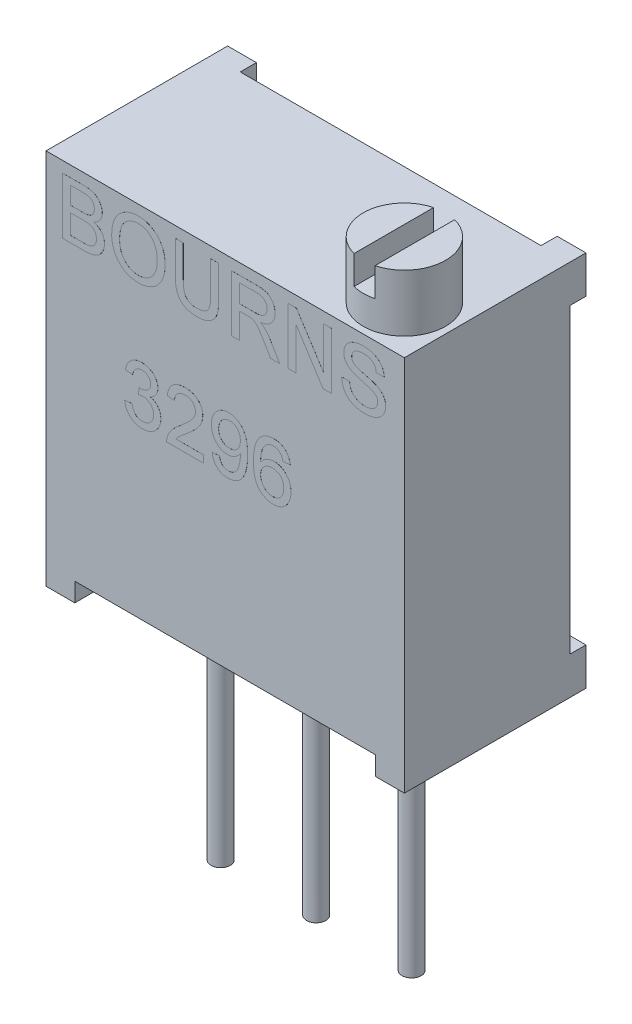
from build123d import *

# Parameters (mm, degrees)
SKETCH1_W          = 9.53
SKETCH1_H          = 10.03
EXTRUDE1_DEPTH     = 4.4
SKETCH2_W          = 8
SKETCH2_H          = 0.5
CUT_EXTRUDE1_DEPTH = 12.94429257
SKETCH3_W          = 0.765
SKETCH3_H          = 1
EXTRUDE2_DEPTH     = 0.43
SKETCH4_R          = 0.255
EXTRUDE3_DEPTH     = 6.9
SKETCH5_R          = 1.095
EXTRUDE4_DEPTH     = 1.52
SKETCH6_W          = 0.56
SKETCH6_H          = 3.177194403
CUT_EXTRUDE2_DEPTH = 0.76
EXTRUDE5_DEPTH     = 0.001


with BuildPart() as part:
    # Sketch1 → Extrude1 (new body)
    with BuildSketch(Plane.XY):
        with Locations((0, 5.015)):
            Rectangle(SKETCH1_W, SKETCH1_H)
    extrude(amount=EXTRUDE1_DEPTH)

    # Sketch2 → Cut-Extrude1 (cut, through all)
    with BuildSketch(Plane.XY.offset(4.4)):
        with Locations((0, 0.25)):
            Rectangle(SKETCH2_W, SKETCH2_H)
    extrude(amount=-CUT_EXTRUDE1_DEPTH, mode=Mode.SUBTRACT)

    # Sketch3 → Extrude2 (add)
    with BuildSketch(Plane(origin=(0, 0, 0), x_dir=(-1, 0, 0), z_dir=(0, 0, -1))):
        with Locations((-4.3825, 0.5)):
            Rectangle(SKETCH3_W, SKETCH3_H)
        with Locations((4.3825, 0.5)):
            Rectangle(SKETCH3_W, SKETCH3_H)
        with Locations((4.3825, 9.53)):
            Rectangle(SKETCH3_W, SKETCH3_H)
        with Locations((-4.3825, 9.53)):
            Rectangle(SKETCH3_W, SKETCH3_H)
    extrude(amount=EXTRUDE2_DEPTH)

    # Sketch4 → Extrude3 (add)
    with BuildSketch(Plane.XZ.offset(-0.5)):
        with Locations(Location((2.54, 1.98, 0), (0, 0, 90))):
            Circle(SKETCH4_R)
        with Locations(Location((0, 1.98, 0), (0, 0, 90))):
            Circle(SKETCH4_R)
        with Locations(Location((-2.54, 1.98, 0), (0, 0, 90))):
            Circle(SKETCH4_R)
    extrude(amount=EXTRUDE3_DEPTH)

    # Sketch5 → Extrude4 (add)
    with BuildSketch(Plane(origin=(0, 10.03, 0), x_dir=(-1, 0, 0), z_dir=(0, 1, 0))):
        with Locations(Location((-3.495, 3.13, 0), (0, 0, 270))):
            Circle(SKETCH5_R)
    extrude(amount=EXTRUDE4_DEPTH)

    # Sketch6 → Cut-Extrude2 (cut)
    with BuildSketch(Plane(origin=(0, 11.55, 0), x_dir=(-1, 0, 0), z_dir=(0, 1, 0))):
        with Locations((-3.495, 3.181606458)):
            Rectangle(SKETCH6_W, SKETCH6_H)
    extrude(amount=-CUT_EXTRUDE2_DEPTH, mode=Mode.SUBTRACT)

    # Sketch7 → Extrude5 (add)
    # profile 1 of 10: a face of its own
    with BuildSketch(Plane.XY.offset(4.4)):
        with BuildLine():
            Line((-4.326444342, 8.237150921), (-4.326444342, 9.737150921))
            Line((-4.326444342, 9.737150921), (-3.764845784, 9.737150921))
            add(Edge.make_bspline(
                [(-3.764845784, 9.737150921), (-3.750919069, 9.737097495), (-3.723744088, 9.736993245), (-3.684062996, 9.734386066), (-3.64648204, 9.730819986), (-3.610920315, 9.726223199), (-3.577531697, 9.719553354), (-3.5463473, 9.711473284), (-3.517204841, 9.702153183), (-3.481582627, 9.687955652), (-3.44053193, 9.666102632), (-3.396562734, 9.63349448), (-3.358307825, 9.594343785), (-3.326829661, 9.549455296), (-3.300895048, 9.501505925), (-3.282507712, 9.451409151), (-3.270751692, 9.400255705), (-3.269417834, 9.365618225), (-3.268752034, 9.348328806)],
                knots=[0, 0, 0, 0, 0.939712594, 1.833646414, 2.682508961, 3.487467313, 4.25240329, 4.978730417, 5.660668875, 6.315918528, 7.564895217, 8.787077865, 9.996481721, 11.241996224, 12.475862915, 13.665015424, 14.834484263, 16, 16, 16, 16], degree=3))
            add(Edge.make_bspline(
                [(-3.268752034, 9.348328806), (-3.26945193, 9.332243346), (-3.270844975, 9.300227505), (-3.281932051, 9.253066225), (-3.29943085, 9.207272915), (-3.324174647, 9.163404285), (-3.35580032, 9.122262901), (-3.395007125, 9.085240754), (-3.441231661, 9.052258501), (-3.475923175, 9.03467799), (-3.49381213, 9.025612459)],
                knots=[0, 0, 0, 0, 0.926741525, 1.844548388, 2.778836836, 3.746021974, 4.738420572, 5.759761325, 6.844803049, 8, 8, 8, 8], degree=3))
            add(Edge.make_bspline(
                [(-3.49381213, 9.025612459), (-3.482745904, 9.022148256), (-3.461080115, 9.015365935), (-3.429933293, 9.002955239), (-3.40069594, 8.988823885), (-3.373304413, 8.972948652), (-3.347943795, 8.955182527), (-3.324685642, 8.935497814), (-3.303368694, 8.914199128), (-3.284031035, 8.891299426), (-3.267044931, 8.866946071), (-3.251810517, 8.841671332), (-3.2392306, 8.815170846), (-3.228919301, 8.787513414), (-3.220874955, 8.758869935), (-3.215098238, 8.729130241), (-3.211805658, 8.698363557), (-3.211311122, 8.677463121), (-3.211059726, 8.666838421)],
                knots=[0, 0, 0, 0, 1.127427615, 2.20731145, 3.257257018, 4.283066884, 5.282973838, 6.264540225, 7.242620376, 8.210460609, 9.17525685, 10.12748095, 11.077310519, 12.023587065, 12.994999128, 13.967387486, 14.966724908, 16, 16, 16, 16], degree=3))
            add(Edge.make_bspline(
                [(-3.211059726, 8.666838421), (-3.211577892, 8.649780613), (-3.212604959, 8.615969962), (-3.220853456, 8.56620637), (-3.234792977, 8.518337989), (-3.253979542, 8.473138792), (-3.276841107, 8.43134548), (-3.302824076, 8.394052338), (-3.331265831, 8.36164311), (-3.362967261, 8.334381157), (-3.397723879, 8.311243736), (-3.436517359, 8.291760514), (-3.479047757, 8.27457818), (-3.526179479, 8.260852297), (-3.577891071, 8.249948474), (-3.634884306, 8.242864242), (-3.697246747, 8.237792882), (-3.74069542, 8.237370888), (-3.76334338, 8.237150921)],
                knots=[0, 0, 0, 0, 1.028073207, 2.037766189, 3.031549473, 4.027532207, 4.992436545, 5.898794514, 6.762903869, 7.584966804, 8.412380356, 9.273953678, 10.198004568, 11.174406109, 12.229717296, 13.381036288, 14.634844708, 16, 16, 16, 16], degree=3))
            Line((-3.76334338, 8.237150921), (-4.326444342, 8.237150921))
        make_face()
        with BuildLine():
            Line((-4.11490588, 9.102535536), (-3.805711169, 9.102535536))
            add(Edge.make_bspline(
                [(-3.805711169, 9.102535536), (-3.795593548, 9.102575565), (-3.776155313, 9.10265247), (-3.748116122, 9.103724756), (-3.722237293, 9.104639569), (-3.698618928, 9.106935678), (-3.677144021, 9.109184615), (-3.65789851, 9.112212035), (-3.640788132, 9.115623251), (-3.630311444, 9.11878741), (-3.625422707, 9.120263902)],
                knots=[0, 0, 0, 0, 1.335841395, 2.566453063, 3.705076039, 4.753984432, 5.69893722, 6.555639608, 7.326018133, 8, 8, 8, 8], degree=3))
            add(Edge.make_bspline(
                [(-3.625422707, 9.120263902), (-3.613935929, 9.124287721), (-3.591791825, 9.132044802), (-3.562116654, 9.149661914), (-3.536842034, 9.170802362), (-3.516035695, 9.195839435), (-3.500047055, 9.224639144), (-3.48819194, 9.256604254), (-3.481701001, 9.292181608), (-3.480773445, 9.316853252), (-3.480290496, 9.329698998)],
                knots=[0, 0, 0, 0, 1.059015028, 2.041559358, 2.989777133, 3.920090524, 4.862499371, 5.848878527, 6.879979022, 8, 8, 8, 8], degree=3))
            add(Edge.make_bspline(
                [(-3.480290496, 9.329698998), (-3.480678819, 9.342044591), (-3.481435618, 9.366104727), (-3.487788265, 9.401044217), (-3.498781285, 9.433548996), (-3.513668845, 9.463611935), (-3.532520451, 9.490357237), (-3.555020501, 9.513351936), (-3.581973973, 9.530734916), (-3.607167395, 9.541578455), (-3.629826882, 9.548362111), (-3.650072338, 9.552375722), (-3.673036723, 9.555912112), (-3.698795607, 9.558918633), (-3.727358734, 9.56125197), (-3.758814112, 9.563105652), (-3.793086864, 9.56389268), (-3.816828774, 9.564012054), (-3.829148669, 9.564073998)],
                knots=[0, 0, 0, 0, 1.216168307, 2.37017178, 3.484610845, 4.588286376, 5.664695412, 6.69777344, 7.738183022, 8.803673002, 9.390844981, 10.0665252, 10.835811589, 11.680682236, 12.621801058, 13.660007223, 14.785756265, 16, 16, 16, 16], degree=3))
            Line((-3.829148669, 9.564073998), (-4.11490588, 9.564073998))
            Line((-4.11490588, 9.564073998), (-4.11490588, 9.102535536))
        make_face(mode=Mode.SUBTRACT)
        with BuildLine():
            Line((-4.11490588, 8.410227844), (-3.760038092, 8.410227844))
            add(Edge.make_bspline(
                [(-3.760038092, 8.410227844), (-3.745915172, 8.410390096), (-3.719967473, 8.410688199), (-3.68447609, 8.41162336), (-3.655788079, 8.41390761), (-3.639035797, 8.416367164), (-3.631732803, 8.417439383)],
                knots=[0, 0, 0, 0, 1.317581857, 2.420761387, 3.311546315, 4, 4, 4, 4], degree=3))
            add(Edge.make_bspline(
                [(-3.631732803, 8.417439383), (-3.621262478, 8.419640139), (-3.60098922, 8.423901372), (-3.572408792, 8.433412), (-3.546204152, 8.444306931), (-3.522832664, 8.458153179), (-3.501191226, 8.47411003), (-3.482383206, 8.494040902), (-3.465060127, 8.516685746), (-3.450051204, 8.542600195), (-3.43791431, 8.571268479), (-3.42863829, 8.602247654), (-3.423697206, 8.635429101), (-3.422969697, 8.658209966), (-3.422598188, 8.669843229)],
                knots=[0, 0, 0, 0, 1.067651492, 2.067249321, 3.003744366, 3.895862395, 4.774133402, 5.679610569, 6.621910665, 7.616993802, 8.661192143, 9.724711987, 10.838102842, 12, 12, 12, 12], degree=3))
            add(Edge.make_bspline(
                [(-3.422598188, 8.669843229), (-3.42301209, 8.683501376), (-3.42381924, 8.710136157), (-3.431491485, 8.748624765), (-3.444164778, 8.784323428), (-3.462005081, 8.816737755), (-3.483887144, 8.845891651), (-3.51036223, 8.870622107), (-3.541232376, 8.890246947), (-3.576592458, 8.905648649), (-3.617921311, 8.916606694), (-3.666359943, 8.924041064), (-3.722683143, 8.928838285), (-3.762931606, 8.929242981), (-3.784377034, 8.929458613)],
                knots=[0, 0, 0, 0, 0.96167883, 1.875371887, 2.752872588, 3.621584364, 4.472914353, 5.312011319, 6.159851575, 7.038572308, 8.019870099, 9.164119506, 10.488969081, 12, 12, 12, 12], degree=3))
            Line((-3.784377034, 8.929458613), (-4.11490588, 8.929458613))
            Line((-4.11490588, 8.929458613), (-4.11490588, 8.410227844))
        make_face(mode=Mode.SUBTRACT)
    # profile 2 of 10: a face of its own
    with BuildSketch(Plane.XY.offset(4.4)):
        with BuildLine():
            add(Edge.make_bspline(
                [(-3.018752034, 8.96731919), (-3.018230692, 8.997392897), (-3.017214883, 9.055989991), (-3.007723632, 9.141314909), (-2.992312277, 9.221594495), (-2.970280381, 9.296822497), (-2.942354889, 9.367116795), (-2.90840612, 9.432636561), (-2.867412916, 9.492640158), (-2.821039156, 9.547698782), (-2.769241797, 9.596374641), (-2.714092331, 9.639605778), (-2.654902115, 9.675665657), (-2.592218021, 9.705439229), (-2.525773732, 9.728298516), (-2.455755803, 9.744302096), (-2.382239117, 9.754625961), (-2.331988742, 9.755787946), (-2.30631213, 9.75638169)],
                knots=[0, 0, 0, 0, 1.203621547, 2.345195544, 3.432004029, 4.472479546, 5.478447225, 6.455936844, 7.420185704, 8.381829745, 9.332027588, 10.260832629, 11.182364398, 12.100723901, 13.034044877, 13.989196293, 14.972532542, 16, 16, 16, 16], degree=3))
            add(Edge.make_bspline(
                [(-2.30631213, 9.75638169), (-2.289376641, 9.756085965), (-2.255745821, 9.755498707), (-2.206025657, 9.751030463), (-2.157583125, 9.74305542), (-2.110465931, 9.732367968), (-2.064545821, 9.718346497), (-2.019795371, 9.701794576), (-1.976606323, 9.681284416), (-1.934691352, 9.658321251), (-1.894545231, 9.632635958), (-1.856816008, 9.604261466), (-1.821594055, 9.573412372), (-1.788406246, 9.540595749), (-1.758360012, 9.504704083), (-1.730214065, 9.466830696), (-1.704777197, 9.426304031), (-1.681959152, 9.383456134), (-1.661557501, 9.338948785), (-1.644120351, 9.292597519), (-1.629147388, 9.24495835), (-1.616613755, 9.195749307), (-1.607620535, 9.144987212), (-1.600459136, 9.092890794), (-1.596689895, 9.039289785), (-1.596016226, 9.003081348), (-1.595675111, 8.984747075)],
                knots=[0, 0, 0, 0, 1.034375294, 2.054082248, 3.045783978, 4.031219655, 5.002789406, 5.976610191, 6.94273282, 7.920236376, 8.894345378, 9.851183672, 10.800797181, 11.752517031, 12.698794154, 13.65688337, 14.632873302, 15.61821402, 16.620222298, 17.621258913, 18.640965868, 19.669244166, 20.720417492, 21.788124603, 22.880008887, 24, 24, 24, 24], degree=3))
            add(Edge.make_bspline(
                [(-1.595675111, 8.984747075), (-1.595987646, 8.966110469), (-1.596605114, 8.929290641), (-1.600783152, 8.87489649), (-1.608129594, 8.822063882), (-1.617873399, 8.77063528), (-1.630929801, 8.720717747), (-1.646445328, 8.672168168), (-1.665212234, 8.625275712), (-1.686407371, 8.579927361), (-1.71038966, 8.536746809), (-1.736843752, 8.496035998), (-1.765788388, 8.458175743), (-1.796783902, 8.422701596), (-1.830554122, 8.390247902), (-1.866683213, 8.360511195), (-1.90503226, 8.333211022), (-1.945730096, 8.30908676), (-1.988046343, 8.287940982), (-2.031143628, 8.269180868), (-2.075053966, 8.253181495), (-2.119927428, 8.240215594), (-2.165641605, 8.230417626), (-2.21206785, 8.223080805), (-2.259358356, 8.218856237), (-2.291179863, 8.218233784), (-2.307213572, 8.217920152)],
                knots=[0, 0, 0, 0, 1.141429366, 2.255090526, 3.338676798, 4.407031443, 5.458968682, 6.496860253, 7.526652771, 8.550250826, 9.560787671, 10.54935636, 11.521089193, 12.477323897, 13.431786008, 14.386110112, 15.340986122, 16.312041, 17.28047646, 18.236612773, 19.189437236, 20.140779471, 21.09494583, 22.051062463, 23.018000708, 24, 24, 24, 24], degree=3))
            add(Edge.make_bspline(
                [(-2.307213572, 8.217920152), (-2.324453371, 8.218175217), (-2.358601094, 8.218680436), (-2.409072348, 8.223723391), (-2.458287957, 8.231416594), (-2.506104842, 8.242523255), (-2.552457663, 8.25701268), (-2.597401266, 8.27455022), (-2.641093722, 8.294901493), (-2.682992881, 8.318649222), (-2.722956135, 8.345054144), (-2.760596145, 8.373985002), (-2.795892098, 8.405175171), (-2.828277639, 8.439140188), (-2.858801633, 8.474648809), (-2.886243593, 8.513020865), (-2.911499732, 8.55338612), (-2.933822678, 8.596133677), (-2.95398812, 8.639993241), (-2.97097794, 8.68497884), (-2.985908699, 8.730427507), (-2.997799537, 8.776619369), (-3.007275088, 8.823447871), (-3.01364671, 8.870835093), (-3.018248343, 8.918851609), (-3.018583292, 8.951082028), (-3.018752034, 8.96731919)],
                knots=[0, 0, 0, 0, 1.072727997, 2.12480551, 3.153819198, 4.171534612, 5.177148798, 6.173931848, 7.17235114, 8.174500385, 9.168706755, 10.151274001, 11.127173509, 12.097141049, 13.070188938, 14.039134204, 15.03036519, 16.031505612, 17.038625933, 18.033164522, 19.022845559, 20.014762458, 21.000193215, 21.994692725, 22.989758729, 24, 24, 24, 24], degree=3))
        make_face()
        with BuildLine():
            add(Edge.make_bspline(
                [(-2.807213572, 8.964915344), (-2.8068894, 8.943259561), (-2.806257286, 8.901032314), (-2.799025562, 8.839467232), (-2.788052575, 8.781377442), (-2.772927471, 8.726599873), (-2.752595628, 8.675676265), (-2.728286277, 8.628117292), (-2.699180916, 8.584239101), (-2.665921697, 8.544164434), (-2.629340369, 8.508164356), (-2.590249507, 8.476720203), (-2.548640324, 8.450387949), (-2.504974133, 8.428645052), (-2.458937298, 8.411672739), (-2.410667702, 8.399755208), (-2.360129877, 8.39230176), (-2.325669313, 8.391437388), (-2.308115015, 8.390997075)],
                knots=[0, 0, 0, 0, 1.215430442, 2.370003584, 3.475209778, 4.53279855, 5.55522989, 6.548792651, 7.526809858, 8.505409025, 9.467826767, 10.404123909, 11.316848639, 12.227335424, 13.138360512, 14.065900994, 15.014765094, 16, 16, 16, 16], degree=3))
            add(Edge.make_bspline(
                [(-2.308115015, 8.390997075), (-2.290263171, 8.3914439), (-2.25530931, 8.392318784), (-2.204009559, 8.399642118), (-2.155269053, 8.412109783), (-2.108604686, 8.42870707), (-2.064860106, 8.451143772), (-2.02301225, 8.477417027), (-1.984201898, 8.509522192), (-1.947476365, 8.54558594), (-1.914536035, 8.586579013), (-1.885308427, 8.631491621), (-1.861565976, 8.680997339), (-1.841067574, 8.734005623), (-1.826057462, 8.791518352), (-1.81496407, 8.85288172), (-1.808278957, 8.918293114), (-1.80757498, 8.963196823), (-1.807213572, 8.986249479)],
                knots=[0, 0, 0, 0, 0.976878588, 1.912725521, 2.8289017, 3.727303729, 4.617335839, 5.514666588, 6.426584173, 7.368641557, 8.327632997, 9.299405846, 10.294892156, 11.327373912, 12.405931897, 13.542618837, 14.738430195, 16, 16, 16, 16], degree=3))
            add(Edge.make_bspline(
                [(-1.807213572, 8.986249479), (-1.807341294, 9.001080057), (-1.807591837, 9.030172285), (-1.810909864, 9.073054562), (-1.815189695, 9.114602954), (-1.821705802, 9.15476385), (-1.830685826, 9.193370934), (-1.840634167, 9.230718122), (-1.853074219, 9.266483577), (-1.867189192, 9.300807558), (-1.882983608, 9.333513851), (-1.900797609, 9.36432673), (-1.920424159, 9.3931264), (-1.941333711, 9.420458875), (-1.964684118, 9.445266276), (-1.989351045, 9.468596479), (-2.015894798, 9.489967476), (-2.044050482, 9.509384851), (-2.073418672, 9.526863548), (-2.103938825, 9.541823045), (-2.135124711, 9.554963084), (-2.167498339, 9.565035475), (-2.200612691, 9.573159006), (-2.234601633, 9.579329585), (-2.269591323, 9.582524997), (-2.293185557, 9.583042977), (-2.305110207, 9.583304767)],
                knots=[0, 0, 0, 0, 1.220438779, 2.394059227, 3.538503547, 4.658058814, 5.74010225, 6.800155734, 7.837851593, 8.854470756, 9.853724944, 10.825214244, 11.781044712, 12.72106398, 13.654479919, 14.581868691, 15.514082315, 16.456304431, 17.39516604, 18.324312202, 19.252140633, 20.177768678, 21.111585046, 22.057694709, 23.018348693, 24, 24, 24, 24], degree=3))
            add(Edge.make_bspline(
                [(-2.305110207, 9.583304767), (-2.321964073, 9.582970056), (-2.355218629, 9.582309634), (-2.404173295, 9.574968014), (-2.4513709, 9.56399863), (-2.496884691, 9.548662848), (-2.540325395, 9.528355862), (-2.581918075, 9.503452123), (-2.622031926, 9.47462972), (-2.660034411, 9.441186401), (-2.695461039, 9.402768193), (-2.725410699, 9.357474302), (-2.750653091, 9.30638599), (-2.771730023, 9.249632752), (-2.787800563, 9.186775074), (-2.798907316, 9.11808346), (-2.805919894, 9.043485528), (-2.806771322, 8.991774955), (-2.807213572, 8.964915344)],
                knots=[0, 0, 0, 0, 0.895090134, 1.766112571, 2.624765742, 3.468151641, 4.313618154, 5.168136083, 6.041303099, 6.935189387, 7.854749729, 8.809996334, 9.809869957, 10.877771942, 12.021723904, 13.25217762, 14.572720513, 16, 16, 16, 16], degree=3))
        make_face(mode=Mode.SUBTRACT)
    # profile 3 of 10: a face of its own
    with BuildSketch(Plane.XY.offset(4.4)):
        with BuildLine():
            Line((-0.384136649, 9.737150921), (-0.172598188, 9.737150921))
            Line((-0.172598188, 9.737150921), (-0.172598188, 8.874170152))
            add(Edge.make_bspline(
                [(-0.172598188, 8.874170152), (-0.172817713, 8.855839279), (-0.17324491, 8.820167371), (-0.175210197, 8.768143941), (-0.179038667, 8.719011196), (-0.184899968, 8.672848597), (-0.19152619, 8.629455925), (-0.200351288, 8.589070404), (-0.210472953, 8.551529041), (-0.222118871, 8.516578197), (-0.236215171, 8.483981753), (-0.252320236, 8.453041696), (-0.27110134, 8.423667691), (-0.292509773, 8.395904321), (-0.316659126, 8.369903341), (-0.342889972, 8.34499824), (-0.371894747, 8.32187367), (-0.403354379, 8.300264922), (-0.437307933, 8.280653275), (-0.473904053, 8.263733066), (-0.513098094, 8.24978275), (-0.554713075, 8.237914738), (-0.59895675, 8.229115881), (-0.645687182, 8.222441781), (-0.694966239, 8.218516166), (-0.728680904, 8.218121765), (-0.745915496, 8.217920152)],
                knots=[0, 0, 0, 0, 1.311435591, 2.552055809, 3.723716842, 4.835547674, 5.880436826, 6.862821995, 7.791032428, 8.661143393, 9.495683908, 10.328993084, 11.1538804, 11.986573222, 12.833449924, 13.690091648, 14.571895854, 15.484149563, 16.418232274, 17.373591634, 18.364096258, 19.391643703, 20.466661433, 21.588422397, 22.767226238, 24, 24, 24, 24], degree=3))
            add(Edge.make_bspline(
                [(-0.745915496, 8.217920152), (-0.762747176, 8.218167913), (-0.795542393, 8.218650658), (-0.843600901, 8.221914973), (-0.889315102, 8.227699697), (-0.932822961, 8.235291305), (-0.973978437, 8.245579942), (-1.01272043, 8.258173326), (-1.049181209, 8.272904412), (-1.083365134, 8.2896649), (-1.11487259, 8.309015777), (-1.144260591, 8.330138013), (-1.171397739, 8.353261603), (-1.19603194, 8.378594967), (-1.218455258, 8.405756623), (-1.238355176, 8.435036855), (-1.255779343, 8.466487887), (-1.271165901, 8.500026899), (-1.284571795, 8.536147585), (-1.295381776, 8.575342209), (-1.305161568, 8.617510171), (-1.312667758, 8.662804669), (-1.319261137, 8.711168829), (-1.323084681, 8.762745583), (-1.325997838, 8.817446196), (-1.326292931, 8.854934905), (-1.326444342, 8.874170152)],
                knots=[0, 0, 0, 0, 1.192889473, 2.324252067, 3.41162405, 4.457325556, 5.452435892, 6.415456921, 7.342133401, 8.237363544, 9.110250727, 9.959377435, 10.800155199, 11.633438097, 12.46053001, 13.293359256, 14.138649731, 15.005774073, 15.906391469, 16.865847877, 17.8852706, 18.972920589, 20.118424796, 21.343408205, 22.636917643, 24, 24, 24, 24], degree=3))
            Line((-1.326444342, 8.874170152), (-1.326444342, 9.737150921))
            Line((-1.326444342, 9.737150921), (-1.11490588, 9.737150921))
            Line((-1.11490588, 9.737150921), (-1.11490588, 8.884086017))
            add(Edge.make_bspline(
                [(-1.11490588, 8.884086017), (-1.114767658, 8.868560422), (-1.114500957, 8.838603557), (-1.113109482, 8.795207672), (-1.110326775, 8.754936554), (-1.106886612, 8.717728723), (-1.102157025, 8.683718544), (-1.09610028, 8.652955825), (-1.089306625, 8.625335805), (-1.079133218, 8.593035516), (-1.062246323, 8.556979041), (-1.035633784, 8.518762127), (-1.003161194, 8.485560874), (-0.964517851, 8.458141879), (-0.920633994, 8.436355447), (-0.871805449, 8.421333433), (-0.818611502, 8.411672805), (-0.781617528, 8.410721136), (-0.762441938, 8.410227844)],
                knots=[0, 0, 0, 0, 1.090245215, 2.103644224, 3.048223674, 3.924421557, 4.727106666, 5.45815927, 6.12513286, 6.723455763, 7.834131158, 8.905266051, 9.9795367, 11.078391299, 12.21701853, 13.404826756, 14.65480846, 16, 16, 16, 16], degree=3))
            add(Edge.make_bspline(
                [(-0.762441938, 8.410227844), (-0.746007063, 8.410507631), (-0.714272984, 8.411047872), (-0.668513344, 8.415404728), (-0.6265627, 8.423347367), (-0.588072882, 8.433582839), (-0.553314751, 8.447483141), (-0.522075787, 8.464324146), (-0.494465601, 8.484196483), (-0.470286071, 8.507638528), (-0.449452221, 8.535691341), (-0.431893065, 8.569123488), (-0.416934773, 8.607964106), (-0.404676645, 8.652341416), (-0.395738752, 8.702466188), (-0.388751711, 8.758015588), (-0.385088051, 8.819233831), (-0.384462913, 8.861846319), (-0.384136649, 8.884086017)],
                knots=[0, 0, 0, 0, 1.111629428, 2.146443922, 3.104513091, 3.997025448, 4.836178689, 5.630482806, 6.392099463, 7.129930272, 7.899580577, 8.745272349, 9.676297551, 10.710246713, 11.854352966, 13.117392195, 14.495550762, 16, 16, 16, 16], degree=3))
            Line((-0.384136649, 8.884086017), (-0.384136649, 9.737150921))
        make_face()
    # profile 4 of 10: a face of its own
    with BuildSketch(Plane.XY.offset(4.4)):
        with BuildLine():
            Line((0.173555658, 8.237150921), (0.173555658, 9.737150921))
            Line((0.173555658, 9.737150921), (0.824397004, 9.737150921))
            add(Edge.make_bspline(
                [(0.824397004, 9.737150921), (0.839722325, 9.737030841), (0.86938269, 9.73679844), (0.912396343, 9.735153303), (0.952545276, 9.731606819), (0.98990331, 9.727771792), (1.024463806, 9.721885537), (1.05619111, 9.715134136), (1.085134208, 9.707099866), (1.111422492, 9.697610774), (1.135812287, 9.686875288), (1.158419785, 9.673629431), (1.18018475, 9.659114797), (1.200299409, 9.642062268), (1.219294287, 9.623391327), (1.237151779, 9.602848275), (1.25360752, 9.580254841), (1.273903706, 9.547918952), (1.295677375, 9.504854357), (1.313818262, 9.449741006), (1.325515181, 9.39209043), (1.326766785, 9.352692939), (1.327401812, 9.332703806)],
                knots=[0, 0, 0, 0, 1.242255013, 2.404239178, 3.487702428, 4.508875116, 5.447164253, 6.327763259, 7.137389581, 7.87956647, 8.591787438, 9.293660819, 10.000726923, 10.709654955, 11.427269343, 12.158170644, 12.913245971, 13.690346794, 15.251572448, 16.809945773, 18.381459854, 20, 20, 20, 20], degree=3))
            add(Edge.make_bspline(
                [(1.327401812, 9.332703806), (1.327108288, 9.319872565), (1.326528558, 9.294529983), (1.322087769, 9.257269606), (1.314052519, 9.221668814), (1.303748895, 9.187415821), (1.289646376, 9.154995938), (1.273309221, 9.123746979), (1.253069809, 9.094527437), (1.230409548, 9.066559241), (1.204424306, 9.040441395), (1.17488549, 9.017116168), (1.142085913, 8.99613508), (1.105871101, 8.978077007), (1.066657924, 8.96157107), (1.023954363, 8.948279695), (0.977932767, 8.937426268), (0.946028457, 8.93217062), (0.929565274, 8.929458613)],
                knots=[0, 0, 0, 0, 0.982609109, 1.940720374, 2.867584677, 3.775009516, 4.675469332, 5.571146231, 6.471115823, 7.392408543, 8.32534739, 9.286126426, 10.269214477, 11.301811357, 12.381622301, 13.524260118, 14.722474812, 16, 16, 16, 16], degree=3))
            add(Edge.make_bspline(
                [(0.929565274, 8.929458613), (0.941641642, 8.923357898), (0.964575101, 8.911772421), (0.996326759, 8.893606493), (1.02324154, 8.875045391), (1.038834637, 8.861769945), (1.046151812, 8.855540344)],
                knots=[0, 0, 0, 0, 1.172304973, 2.226249348, 3.167654437, 4, 4, 4, 4], degree=3))
            add(Edge.make_bspline(
                [(1.046151812, 8.855540344), (1.060321936, 8.841649482), (1.089428377, 8.813116664), (1.129538316, 8.764516917), (1.16842628, 8.710417941), (1.192053651, 8.671320427), (1.204204697, 8.651213421)],
                knots=[0, 0, 0, 0, 0.918110279, 1.885863737, 2.912745394, 4, 4, 4, 4], degree=3))
            Line((1.204204697, 8.651213421), (1.450298447, 8.237150921))
            Line((1.450298447, 8.237150921), (1.207810466, 8.237150921))
            Line((1.207810466, 8.237150921), (1.020911428, 8.553857652))
            add(Edge.make_bspline(
                [(1.020911428, 8.553857652), (1.014191477, 8.564969688), (1.001169316, 8.58650299), (0.982359271, 8.617951341), (0.96391664, 8.646904558), (0.946811416, 8.674190141), (0.930349439, 8.699312734), (0.914689771, 8.722359607), (0.900263372, 8.743633105), (0.882394413, 8.768400992), (0.861597912, 8.79580689), (0.837329822, 8.82402979), (0.814219405, 8.846531531), (0.7857585, 8.868596883), (0.750505364, 8.88923531), (0.720539532, 8.898718101), (0.706007581, 8.903316786)],
                knots=[0, 0, 0, 0, 1.130940588, 2.191577161, 3.191089816, 4.120344442, 4.99615009, 5.80661983, 6.546979556, 7.234477901, 8.466216387, 9.541989141, 10.473533583, 11.269175393, 12.675684693, 14, 14, 14, 14], degree=3))
            add(Edge.make_bspline(
                [(0.706007581, 8.903316786), (0.699910513, 8.904416295), (0.685990724, 8.906926506), (0.662354957, 8.908565929), (0.633717326, 8.910305957), (0.612963146, 8.910255258), (0.601740754, 8.910227844)],
                knots=[0, 0, 0, 0, 0.709978628, 1.620902492, 2.713552433, 4, 4, 4, 4], degree=3))
            Line((0.601740754, 8.910227844), (0.38509412, 8.910227844))
            Line((0.38509412, 8.910227844), (0.38509412, 8.237150921))
            Line((0.38509412, 8.237150921), (0.173555658, 8.237150921))
        make_face()
        with BuildLine():
            Line((0.38509412, 9.083304767), (0.786836908, 9.083304767))
            add(Edge.make_bspline(
                [(0.786836908, 9.083304767), (0.806981813, 9.083619953), (0.844640824, 9.084209164), (0.897300993, 9.089240406), (0.942179174, 9.097235264), (0.980162544, 9.108896699), (1.012074571, 9.125086645), (1.039829066, 9.144817119), (1.062893402, 9.169531591), (1.082080546, 9.197416611), (1.096995107, 9.228102684), (1.10775376, 9.260333904), (1.114795486, 9.29383939), (1.115504243, 9.31664276), (1.115863351, 9.328196594)],
                knots=[0, 0, 0, 0, 1.546323217, 2.890706218, 4.056530419, 5.041445823, 5.928701482, 6.793137403, 7.641659452, 8.509781392, 9.383301667, 10.251423607, 11.114044887, 12, 12, 12, 12], degree=3))
            add(Edge.make_bspline(
                [(1.115863351, 9.328196594), (1.115584159, 9.336616312), (1.115037306, 9.353108067), (1.11217052, 9.377313385), (1.106596807, 9.400314031), (1.099236732, 9.422231591), (1.089402179, 9.442905533), (1.07771913, 9.462496058), (1.063777647, 9.480894587), (1.047808481, 9.498157164), (1.029472975, 9.513864423), (1.008529518, 9.52741638), (0.985143287, 9.538932621), (0.959287102, 9.548072679), (0.931042413, 9.555383237), (0.90024843, 9.560246716), (0.86704598, 9.563765913), (0.844038607, 9.563969384), (0.832209504, 9.564073998)],
                knots=[0, 0, 0, 0, 0.965208469, 1.890559848, 2.786986821, 3.67262109, 4.535197034, 5.405224191, 6.282113641, 7.175449223, 8.095446547, 9.040936516, 10.026471658, 11.075712529, 12.17809725, 13.364958037, 14.645208957, 16, 16, 16, 16], degree=3))
            Line((0.832209504, 9.564073998), (0.38509412, 9.564073998))
            Line((0.38509412, 9.564073998), (0.38509412, 9.083304767))
        make_face(mode=Mode.SUBTRACT)
    # profile 5 of 10: a face of its own
    with BuildSketch(Plane.XY.offset(4.4)):
        Polygon((1.673555658, 8.237150921), (1.673555658, 9.737150921), (1.897113351, 9.737150921), (2.615863351, 8.617860056), (2.615863351, 9.737150921), (2.827401812, 9.737150921), (2.827401812, 8.237150921), (2.60384412, 8.237150921), (1.88509412, 9.356441786), (1.88509412, 8.237150921), align=None)
    # profile 6 of 10: a face of its own
    with BuildSketch(Plane.XY.offset(4.4)):
        with BuildLine():
            Line((3.096632581, 8.75638169), (3.308171043, 8.75638169))
            add(Edge.make_bspline(
                [(3.308171043, 8.75638169), (3.310497843, 8.737388445), (3.314967752, 8.700901399), (3.327466063, 8.649186503), (3.343552197, 8.602689505), (3.363595075, 8.560793306), (3.389960718, 8.52400024), (3.421726783, 8.490813457), (3.460304939, 8.462075712), (3.503850884, 8.436501001), (3.552348913, 8.416420809), (3.604124885, 8.401535032), (3.658931873, 8.39271509), (3.696460325, 8.391577796), (3.715622966, 8.390997075)],
                knots=[0, 0, 0, 0, 1.125557648, 2.162256852, 3.1243583, 4.018160113, 4.88511607, 5.777380551, 6.711250965, 7.707237736, 8.743031335, 9.791730543, 10.872421559, 12, 12, 12, 12], degree=3))
            add(Edge.make_bspline(
                [(3.715622966, 8.390997075), (3.732580253, 8.391310936), (3.765643678, 8.391922905), (3.813473618, 8.399274166), (3.858481731, 8.409701733), (3.899830369, 8.42547506), (3.937367, 8.444628825), (3.969963359, 8.467795753), (3.997792396, 8.493921683), (4.019584549, 8.523694759), (4.03670403, 8.554891964), (4.049262938, 8.586959473), (4.056744023, 8.619719296), (4.057697308, 8.641761795), (4.058171043, 8.652715825)],
                knots=[0, 0, 0, 0, 1.267006637, 2.470417599, 3.611360613, 4.716023143, 5.771382139, 6.754486395, 7.697536124, 8.612899418, 9.501261124, 10.352596716, 11.181322154, 12, 12, 12, 12], degree=3))
            add(Edge.make_bspline(
                [(4.058171043, 8.652715825), (4.057664611, 8.663558897), (4.056674791, 8.684751666), (4.050224406, 8.71560569), (4.037964538, 8.743846084), (4.022055951, 8.770625489), (3.99992439, 8.795109454), (3.97196366, 8.817669243), (3.937557717, 8.838122166), (3.911878856, 8.849323379), (3.898315274, 8.855239863)],
                knots=[0, 0, 0, 0, 0.942140154, 1.841411588, 2.718743672, 3.605002079, 4.535543111, 5.568170452, 6.715506882, 8, 8, 8, 8], degree=3))
            add(Edge.make_bspline(
                [(3.898315274, 8.855239863), (3.893030701, 8.857408477), (3.881091893, 8.86230777), (3.860629335, 8.868793591), (3.836347919, 8.877180419), (3.807664303, 8.885817486), (3.774732043, 8.894954296), (3.737605968, 8.905295779), (3.696306823, 8.91629338), (3.652005924, 8.927999128), (3.607275516, 8.93990208), (3.564540836, 8.951816178), (3.5252229, 8.963910513), (3.488999639, 8.975555689), (3.456057801, 8.987248909), (3.42630389, 8.998670037), (3.39970081, 9.009587356), (3.383452661, 9.017614692), (3.375779216, 9.021405729)],
                knots=[0, 0, 0, 0, 0.499201778, 1.127787504, 1.87543728, 2.745208432, 3.745951656, 4.863402235, 6.114490242, 7.482339553, 8.869366102, 10.161191451, 11.360587006, 12.46547846, 13.487450326, 14.41601931, 15.251940103, 16, 16, 16, 16], degree=3))
            add(Edge.make_bspline(
                [(3.375779216, 9.021405729), (3.35812476, 9.030943175), (3.324047064, 9.049352927), (3.278182261, 9.082269616), (3.239536508, 9.118796776), (3.208272844, 9.158881439), (3.183772734, 9.201845678), (3.167242617, 9.247762533), (3.155920851, 9.295798527), (3.154862803, 9.328830804), (3.154324889, 9.345624479)],
                knots=[0, 0, 0, 0, 1.158441928, 2.236094408, 3.251151369, 4.220012324, 5.163146324, 6.095083285, 7.031536583, 8, 8, 8, 8], degree=3))
            add(Edge.make_bspline(
                [(3.154324889, 9.345624479), (3.155038808, 9.364220637), (3.156458787, 9.40120826), (3.169054782, 9.455485292), (3.189145635, 9.507714234), (3.212015126, 9.549179557), (3.234317935, 9.580535449), (3.252807132, 9.603117389), (3.273546383, 9.623991357), (3.295896991, 9.643448738), (3.320258496, 9.661198819), (3.346026486, 9.677971103), (3.374133618, 9.692387284), (3.413628319, 9.710735829), (3.466462713, 9.729058566), (3.532974606, 9.745024508), (3.60297619, 9.754426519), (3.650690914, 9.755720748), (3.675058062, 9.75638169)],
                knots=[0, 0, 0, 0, 1.199927478, 2.386647047, 3.578628709, 4.806592355, 5.433127754, 6.062729195, 6.689531802, 7.331674828, 7.974827539, 8.635320743, 9.315455226, 10.01318112, 11.447700238, 12.918145351, 14.426146008, 16, 16, 16, 16], degree=3))
            add(Edge.make_bspline(
                [(3.675058062, 9.75638169), (3.701729524, 9.755770554), (3.753664, 9.754580555), (3.829126262, 9.744679979), (3.899511893, 9.727678083), (3.954710721, 9.708646167), (3.995518568, 9.689378935), (4.024509599, 9.674344909), (4.051419009, 9.656962836), (4.076489036, 9.638152714), (4.099952547, 9.617923133), (4.121206478, 9.595792899), (4.141173733, 9.572517055), (4.16463804, 9.539100235), (4.189937537, 9.494873263), (4.211812397, 9.437575464), (4.22684068, 9.377102341), (4.229764027, 9.335295723), (4.231247966, 9.314073998)],
                knots=[0, 0, 0, 0, 1.607600973, 3.130308851, 4.577334065, 5.967726088, 6.640410691, 7.296826776, 7.935019992, 8.569057421, 9.185393759, 9.8003086, 10.417295362, 11.032210203, 12.259799365, 13.477607022, 14.719591916, 16, 16, 16, 16], degree=3))
            Line((4.231247966, 9.314073998), (4.019709504, 9.314073998))
            add(Edge.make_bspline(
                [(4.019709504, 9.314073998), (4.01836542, 9.324814934), (4.015735446, 9.345831762), (4.009210828, 9.376256782), (4.000064628, 9.404514172), (3.989351623, 9.43086745), (3.97636522, 9.455042515), (3.96122683, 9.477271498), (3.943752103, 9.497292505), (3.924390679, 9.515634568), (3.902553396, 9.531605384), (3.878352458, 9.545468544), (3.851747016, 9.557179739), (3.822760508, 9.566771589), (3.791387195, 9.574208735), (3.757555718, 9.579679641), (3.721279153, 9.582481538), (3.696296049, 9.583025524), (3.683471524, 9.583304767)],
                knots=[0, 0, 0, 0, 1.074487479, 2.102453544, 3.083708351, 4.020042547, 4.923259678, 5.803182661, 6.684453325, 7.556870173, 8.445961597, 9.363679789, 10.320905216, 11.327237703, 12.390948353, 13.519046902, 14.726457512, 16, 16, 16, 16], degree=3))
            add(Edge.make_bspline(
                [(3.683471524, 9.583304767), (3.670141028, 9.583204288), (3.644336467, 9.583009786), (3.607033047, 9.579464247), (3.572457599, 9.574599641), (3.54066951, 9.567423935), (3.511772912, 9.558030911), (3.48533894, 9.547184123), (3.462107376, 9.533438411), (3.441536651, 9.518127475), (3.423791796, 9.50118677), (3.40849836, 9.483335363), (3.394972496, 9.465097741), (3.384462602, 9.445477024), (3.375905969, 9.425216278), (3.370386, 9.403934666), (3.366477733, 9.382025845), (3.366070975, 9.367077017), (3.365863351, 9.359446594)],
                knots=[0, 0, 0, 0, 1.464176581, 2.834285765, 4.113735764, 5.29917439, 6.409476712, 7.449999357, 8.431575861, 9.367089851, 10.262376129, 11.120706676, 11.948504824, 12.751342953, 13.560717798, 14.359016663, 15.162382702, 16, 16, 16, 16], degree=3))
            add(Edge.make_bspline(
                [(3.365863351, 9.359446594), (3.366410016, 9.346541253), (3.367471042, 9.321493177), (3.378305676, 9.285907411), (3.394969419, 9.25346868), (3.411385861, 9.235818932), (3.419649408, 9.226934575)],
                knots=[0, 0, 0, 0, 1.050964922, 2.039826012, 3.013306874, 4, 4, 4, 4], degree=3))
            add(Edge.make_bspline(
                [(3.419649408, 9.226934575), (3.42485866, 9.222494598), (3.4363786, 9.212675865), (3.457813222, 9.19968192), (3.484388976, 9.186553195), (3.516283435, 9.173502227), (3.553441723, 9.160370577), (3.595803905, 9.146849929), (3.643531332, 9.133421398), (3.695169512, 9.120480787), (3.747336115, 9.107488153), (3.796911925, 9.094545037), (3.842430911, 9.082278526), (3.883820853, 9.070314553), (3.921124591, 9.058686949), (3.954212481, 9.0471521), (3.983352215, 9.036542966), (4.001203746, 9.029078573), (4.009493158, 9.025612459)],
                knots=[0, 0, 0, 0, 0.523891492, 1.158553688, 1.913783773, 2.794766643, 3.797521443, 4.933638669, 6.202080764, 7.596537849, 9.013317056, 10.322179469, 11.523240428, 12.626146501, 13.623953177, 14.517289671, 15.311498917, 16, 16, 16, 16], degree=3))
            add(Edge.make_bspline(
                [(4.009493158, 9.025612459), (4.020278105, 9.020639906), (4.041447148, 9.010879618), (4.071435932, 8.994215394), (4.099418721, 8.976910495), (4.125169432, 8.958499014), (4.148604802, 8.938942223), (4.169986865, 8.9184642), (4.189444761, 8.897180034), (4.206193367, 8.874408509), (4.221231896, 8.851070152), (4.23439161, 8.82683878), (4.244987559, 8.801571892), (4.254280868, 8.775574057), (4.260965422, 8.748556105), (4.266207461, 8.720790933), (4.269265054, 8.692148039), (4.269560074, 8.672754984), (4.269709504, 8.662932171)],
                knots=[0, 0, 0, 0, 1.198900896, 2.353241543, 3.461831299, 4.520043694, 5.547003373, 6.541368882, 7.508191797, 8.454912692, 9.392021408, 10.310662301, 11.235020644, 12.156274873, 13.095836685, 14.042125239, 15.00831306, 16, 16, 16, 16], degree=3))
            add(Edge.make_bspline(
                [(4.269709504, 8.662932171), (4.268926683, 8.643328505), (4.267372522, 8.604408712), (4.253990635, 8.547039138), (4.232968398, 8.491448341), (4.208314618, 8.447333981), (4.185009344, 8.413637021), (4.165431815, 8.389417187), (4.143721461, 8.367022259), (4.120412768, 8.345750647), (4.095324767, 8.326036362), (4.068245951, 8.30787269), (4.039462123, 8.29107055), (3.99835954, 8.270596158), (3.943768482, 8.249178), (3.874230433, 8.231341683), (3.800945752, 8.219770823), (3.750623966, 8.218545567), (3.72493787, 8.217920152)],
                knots=[0, 0, 0, 0, 1.197055466, 2.376552968, 3.581957237, 4.820753935, 5.454298064, 6.085440993, 6.72202542, 7.359198513, 8.013298489, 8.67051481, 9.351020706, 10.049282741, 11.476266879, 12.925760103, 14.430794493, 16, 16, 16, 16], degree=3))
            add(Edge.make_bspline(
                [(3.72493787, 8.217920152), (3.708606116, 8.218054929), (3.676614545, 8.218318938), (3.629606503, 8.221516171), (3.584557837, 8.226141125), (3.541512757, 8.233030046), (3.500606247, 8.242067936), (3.461691471, 8.252920696), (3.424676191, 8.265419886), (3.389689739, 8.280118717), (3.356823444, 8.297197153), (3.325486338, 8.315620464), (3.296190645, 8.336504151), (3.268874695, 8.359520058), (3.24284636, 8.384003276), (3.219184437, 8.410953679), (3.19708448, 8.439583141), (3.177051469, 8.47015369), (3.159155022, 8.502265362), (3.143061018, 8.535378874), (3.129501595, 8.569734442), (3.11857399, 8.605158431), (3.109317755, 8.641413784), (3.10289877, 8.678802989), (3.098179316, 8.717208657), (3.097151205, 8.743246885), (3.096632581, 8.75638169)],
                knots=[0, 0, 0, 0, 1.259822038, 2.467811403, 3.633536148, 4.752793854, 5.829021491, 6.863980041, 7.868367876, 8.841470325, 9.788447787, 10.724101269, 11.643985084, 12.560193707, 13.478453146, 14.398077254, 15.323914234, 16.266973849, 17.21495974, 18.158525798, 19.105629373, 20.061269543, 21.017128399, 21.990322895, 22.986232211, 24, 24, 24, 24], degree=3))
        make_face()
    # profile 7 of 10: a face of its own
    with BuildSketch(Plane.XY.offset(4.4)):
        with BuildLine():
            Line((-2.672598188, 5.333304767), (-2.480290496, 5.352535536))
            add(Edge.make_bspline(
                [(-2.480290496, 5.352535536), (-2.477726804, 5.340980551), (-2.47276625, 5.318622512), (-2.463221539, 5.286592299), (-2.453140228, 5.256861098), (-2.440642486, 5.230093926), (-2.428447406, 5.205196116), (-2.414116341, 5.183196423), (-2.398803319, 5.163520844), (-2.382225254, 5.14624244), (-2.364191115, 5.131363625), (-2.344941335, 5.118343859), (-2.324068801, 5.107470601), (-2.301733316, 5.09886163), (-2.278123, 5.091892596), (-2.253109542, 5.08677536), (-2.226560675, 5.083726959), (-2.208363582, 5.083447794), (-2.199040496, 5.083304767)],
                knots=[0, 0, 0, 0, 1.321063709, 2.556160278, 3.730472002, 4.821700466, 5.852032229, 6.822994757, 7.746964065, 8.632786469, 9.490489437, 10.352773447, 11.223141997, 12.11199479, 13.021433979, 13.96892724, 14.959401504, 16, 16, 16, 16], degree=3))
            add(Edge.make_bspline(
                [(-2.199040496, 5.083304767), (-2.188104846, 5.083460683), (-2.166747503, 5.083765187), (-2.135626332, 5.08833391), (-2.106009049, 5.094607201), (-2.078318216, 5.104444082), (-2.052168252, 5.116466568), (-2.027708134, 5.13132381), (-2.004770436, 5.148769931), (-1.983807586, 5.1689236), (-1.965060561, 5.191093278), (-1.948363702, 5.214510116), (-1.934557642, 5.239373924), (-1.922921213, 5.265334486), (-1.914332006, 5.292811314), (-1.908044014, 5.321461784), (-1.903934778, 5.351415467), (-1.903559134, 5.371852703), (-1.903367419, 5.382283133)],
                knots=[0, 0, 0, 0, 1.111377895, 2.170522867, 3.193923215, 4.186422864, 5.152846954, 6.117443035, 7.091571248, 8.078879332, 9.069127402, 10.041602243, 10.999610288, 11.957618333, 12.930786866, 13.922135183, 14.939532534, 16, 16, 16, 16], degree=3))
            add(Edge.make_bspline(
                [(-1.903367419, 5.382283133), (-1.90359274, 5.392209279), (-1.904033565, 5.411628995), (-1.907657496, 5.44013297), (-1.913981176, 5.46719093), (-1.922747309, 5.492959471), (-1.933948627, 5.517400761), (-1.947412282, 5.540716907), (-1.963879435, 5.562396935), (-1.982414668, 5.582673707), (-2.002631199, 5.601354431), (-2.024755088, 5.617244792), (-2.048037734, 5.630958692), (-2.072756612, 5.642032129), (-2.09880909, 5.65082118), (-2.126170331, 5.657138043), (-2.154971882, 5.660763547), (-2.174591141, 5.661204448), (-2.184617419, 5.661429767)],
                knots=[0, 0, 0, 0, 1.072815875, 2.098878726, 3.09954706, 4.07199174, 5.036203424, 6.001873089, 6.97636515, 7.972747947, 8.969130744, 9.945905975, 10.911575641, 11.885646534, 12.868345115, 13.879560892, 14.916365174, 16, 16, 16, 16], degree=3))
            add(Edge.make_bspline(
                [(-2.184617419, 5.661429767), (-2.193444947, 5.661195898), (-2.212179022, 5.660699573), (-2.24174766, 5.656317215), (-2.274499935, 5.650180885), (-2.297132692, 5.644158988), (-2.309016457, 5.640997075)],
                knots=[0, 0, 0, 0, 0.837610211, 1.777604146, 2.833088267, 4, 4, 4, 4], degree=3))
            Line((-2.309016457, 5.640997075), (-2.289184726, 5.814073998))
            add(Edge.make_bspline(
                [(-2.289184726, 5.814073998), (-2.283981344, 5.81350541), (-2.274788758, 5.812500912), (-2.265549816, 5.812131111), (-2.261540496, 5.811970633)],
                knots=[0, 0, 0, 0, 1.132082448, 2, 2, 2, 2], degree=3))
            add(Edge.make_bspline(
                [(-2.261540496, 5.811970633), (-2.243854556, 5.812645875), (-2.209160302, 5.813970488), (-2.158582806, 5.824976915), (-2.110650173, 5.842306178), (-2.073619118, 5.862982503), (-2.046158139, 5.88242971), (-2.028841798, 5.899964126), (-2.013230223, 5.918571684), (-2.001582712, 5.939915226), (-1.991519981, 5.962593255), (-1.985288658, 5.987499118), (-1.980744267, 6.01402742), (-1.980444469, 6.032401642), (-1.980290496, 6.041838421)],
                knots=[0, 0, 0, 0, 1.557468908, 3.055264441, 4.54122591, 6.035034992, 6.780215604, 7.498173296, 8.201377046, 8.913174237, 9.633083494, 10.382644491, 11.169345745, 12, 12, 12, 12], degree=3))
            add(Edge.make_bspline(
                [(-1.980290496, 6.041838421), (-1.980432601, 6.049460825), (-1.98071052, 6.064368098), (-1.983806661, 6.086223733), (-1.988927297, 6.106932621), (-1.995848347, 6.126715875), (-2.004919069, 6.145469814), (-2.016167477, 6.16317148), (-2.029019165, 6.180179965), (-2.044190128, 6.195616382), (-2.060436913, 6.210108884), (-2.078351973, 6.222314544), (-2.097082686, 6.233157478), (-2.117289642, 6.241350978), (-2.138473977, 6.24808737), (-2.16081678, 6.252807961), (-2.184326204, 6.255978154), (-2.200431849, 6.256245285), (-2.20865588, 6.25638169)],
                knots=[0, 0, 0, 0, 1.041493611, 2.036867705, 3.009952345, 3.954088258, 4.897230656, 5.850851638, 6.817653571, 7.805463921, 8.805067469, 9.788883576, 10.763797054, 11.758134544, 12.762883247, 13.799594994, 14.876406454, 16, 16, 16, 16], degree=3))
            add(Edge.make_bspline(
                [(-2.20865588, 6.25638169), (-2.224750101, 6.25575415), (-2.255830428, 6.254542277), (-2.300328621, 6.243329936), (-2.340652019, 6.22518691), (-2.370505519, 6.203910205), (-2.391704128, 6.183568472), (-2.406183902, 6.166326507), (-2.419135238, 6.14728635), (-2.430594845, 6.126454787), (-2.440407899, 6.103748041), (-2.449254094, 6.079447415), (-2.45610187, 6.053163856), (-2.459379093, 6.03495194), (-2.461059726, 6.025612459)],
                knots=[0, 0, 0, 0, 1.533565899, 2.961543033, 4.347411787, 5.731829577, 6.434842101, 7.147085226, 7.87612511, 8.629021686, 9.412189982, 10.234506416, 11.094615066, 12, 12, 12, 12], degree=3))
            Line((-2.461059726, 6.025612459), (-2.653367419, 6.044843229))
            add(Edge.make_bspline(
                [(-2.653367419, 6.044843229), (-2.650359152, 6.059712669), (-2.644458201, 6.088880246), (-2.632436042, 6.131006175), (-2.617775167, 6.170550427), (-2.600172323, 6.207331698), (-2.580459125, 6.241790174), (-2.557718521, 6.273517124), (-2.532483664, 6.302701169), (-2.504709731, 6.329253292), (-2.47477377, 6.352967309), (-2.442826559, 6.373423759), (-2.409130278, 6.390763549), (-2.373653378, 6.404742488), (-2.336423948, 6.416109483), (-2.297336073, 6.423640145), (-2.256566677, 6.428734259), (-2.22880438, 6.429214191), (-2.214665496, 6.429458613)],
                knots=[0, 0, 0, 0, 1.136581168, 2.229493434, 3.279335563, 4.293305329, 5.282068175, 6.250623624, 7.213783178, 8.169396253, 9.125981663, 10.071280146, 11.007896369, 11.961295906, 12.925420184, 13.920544621, 14.940967302, 16, 16, 16, 16], degree=3))
            add(Edge.make_bspline(
                [(-2.214665496, 6.429458613), (-2.195093913, 6.428823955), (-2.156609855, 6.427576012), (-2.100085741, 6.417664695), (-2.046020723, 6.401400026), (-1.99484986, 6.378854296), (-1.947453519, 6.351304007), (-1.905511663, 6.318286665), (-1.869584999, 6.280373461), (-1.840371323, 6.237978896), (-1.81723819, 6.192841353), (-1.800120366, 6.145986627), (-1.78989221, 6.097468653), (-1.788620567, 6.064621997), (-1.787982803, 6.048148517)],
                knots=[0, 0, 0, 0, 1.104647871, 2.172094857, 3.229560912, 4.285649672, 5.322588163, 6.317201348, 7.289435229, 8.260615662, 9.214246199, 10.146367077, 11.070353327, 12, 12, 12, 12], degree=3))
            add(Edge.make_bspline(
                [(-1.787982803, 6.048148517), (-1.788629368, 6.032576187), (-1.789905978, 6.001829368), (-1.799734371, 5.956872071), (-1.816342401, 5.914280088), (-1.83879022, 5.873903983), (-1.867899534, 5.83661692), (-1.903590389, 5.803390749), (-1.945291823, 5.773907545), (-1.976543521, 5.758561863), (-1.992610207, 5.750672556)],
                knots=[0, 0, 0, 0, 0.975609618, 1.926294443, 2.868398979, 3.832526731, 4.812148358, 5.820404151, 6.879456693, 8, 8, 8, 8], degree=3))
            add(Edge.make_bspline(
                [(-1.992610207, 5.750672556), (-1.981838566, 5.747952929), (-1.960740066, 5.742625976), (-1.930437835, 5.731588677), (-1.901950336, 5.718666778), (-1.874898419, 5.704031206), (-1.850067451, 5.68672227), (-1.826601532, 5.667796911), (-1.805387727, 5.64634367), (-1.785811434, 5.623127179), (-1.767999411, 5.598390402), (-1.753010419, 5.571652154), (-1.740075355, 5.543615335), (-1.729045562, 5.514076596), (-1.721119577, 5.482808171), (-1.715452248, 5.450052296), (-1.711712273, 5.415922777), (-1.711279374, 5.392609557), (-1.711059726, 5.380780729)],
                knots=[0, 0, 0, 0, 1.053251915, 2.063013066, 3.05373318, 4.018979697, 4.975584284, 5.920798056, 6.874756953, 7.832116109, 8.799604348, 9.761196922, 10.734637845, 11.72654167, 12.747371341, 13.789206138, 14.878271633, 16, 16, 16, 16], degree=3))
            add(Edge.make_bspline(
                [(-1.711059726, 5.380780729), (-1.711425738, 5.364631533), (-1.712145069, 5.332893182), (-1.718964348, 5.286268821), (-1.73010858, 5.241596415), (-1.745530703, 5.198724265), (-1.765072972, 5.157477403), (-1.789595297, 5.11843789), (-1.818370892, 5.08128839), (-1.85094989, 5.046384595), (-1.8866433, 5.014306932), (-1.925404978, 4.986530744), (-1.966468027, 4.962942767), (-2.00989927, 4.943706888), (-2.055583572, 4.928594139), (-2.10356638, 4.917760838), (-2.153996175, 4.911393995), (-2.188405181, 4.910621677), (-2.205951553, 4.910227844)],
                knots=[0, 0, 0, 0, 1.016055063, 1.996874249, 2.958724482, 3.910019225, 4.860394196, 5.826121543, 6.806008102, 7.814207964, 8.82789325, 9.821757317, 10.810247154, 11.803791187, 12.806673825, 13.834534493, 14.895752369, 16, 16, 16, 16], degree=3))
            add(Edge.make_bspline(
                [(-2.205951553, 4.910227844), (-2.221697966, 4.910524443), (-2.252697303, 4.911108344), (-2.298073931, 4.917191604), (-2.341547099, 4.925824448), (-2.382773046, 4.939133015), (-2.422230649, 4.955362596), (-2.459251637, 4.976125898), (-2.494501678, 4.999961364), (-2.527318995, 5.027549979), (-2.557521337, 5.058000599), (-2.584465438, 5.090862833), (-2.607602521, 5.126063716), (-2.628002396, 5.163076576), (-2.64449077, 5.202599125), (-2.65732958, 5.244292036), (-2.667119345, 5.288000573), (-2.670752036, 5.318039058), (-2.672598188, 5.333304767)],
                knots=[0, 0, 0, 0, 1.08471039, 2.135426191, 3.150939737, 4.135689946, 5.116584603, 6.086901885, 7.055842759, 8.045878862, 9.036901429, 10.008421467, 10.96965771, 11.936653536, 12.917548193, 13.915472582, 14.940632654, 16, 16, 16, 16], degree=3))
        make_face()
    # profile 8 of 10: a face of its own
    with BuildSketch(Plane.XY.offset(4.4)):
        with BuildLine():
            Line((-0.576444342, 5.121766306), (-0.576444342, 4.929458613))
            Line((-0.576444342, 4.929458613), (-1.557213572, 4.929458613))
            add(Edge.make_bspline(
                [(-1.557213572, 4.929458613), (-1.557233651, 4.940888), (-1.557273742, 4.963708465), (-1.553412152, 4.997458485), (-1.547364128, 5.030760782), (-1.54052563, 5.052116221), (-1.537081361, 5.062872075)],
                knots=[0, 0, 0, 0, 1.01057331, 2.01775941, 3.001627217, 4, 4, 4, 4], degree=3))
            add(Edge.make_bspline(
                [(-1.537081361, 5.062872075), (-1.530717497, 5.080445856), (-1.517759623, 5.116228969), (-1.491506833, 5.167859003), (-1.460627349, 5.21917679), (-1.430561824, 5.260956713), (-1.403028296, 5.294335951), (-1.379937843, 5.320451342), (-1.354349389, 5.347183521), (-1.326283426, 5.374527607), (-1.296010071, 5.402660696), (-1.263488017, 5.43167661), (-1.228333229, 5.461034607), (-1.203791508, 5.480494308), (-1.191227996, 5.490456209)],
                knots=[0, 0, 0, 0, 1.204657718, 2.452881516, 3.728232997, 5.065887527, 5.768225529, 6.518857853, 7.313994055, 8.154655305, 9.046094665, 9.979688118, 10.965752482, 12, 12, 12, 12], degree=3))
            add(Edge.make_bspline(
                [(-1.191227996, 5.490456209), (-1.171927337, 5.506701261), (-1.134762694, 5.537982137), (-1.082280394, 5.584400059), (-1.034346357, 5.627501728), (-0.991723876, 5.66804259), (-0.954064344, 5.705629425), (-0.921279337, 5.740177074), (-0.893086762, 5.771577722), (-0.869830796, 5.800967939), (-0.850209023, 5.828720478), (-0.833581303, 5.855791366), (-0.819724306, 5.882653473), (-0.80818328, 5.909221798), (-0.79905531, 5.935609961), (-0.7928333, 5.961894841), (-0.788613748, 5.987815629), (-0.788191578, 6.005063609), (-0.787982803, 6.013593229)],
                knots=[0, 0, 0, 0, 1.782554561, 3.432421876, 4.950675607, 6.337395053, 7.588547463, 8.709982106, 9.702713005, 10.569305638, 11.356701089, 12.103210377, 12.812277205, 13.490692607, 14.148717897, 14.782152033, 15.397739362, 16, 16, 16, 16], degree=3))
            add(Edge.make_bspline(
                [(-0.787982803, 6.013593229), (-0.788191603, 6.022023326), (-0.788601258, 6.03856272), (-0.792488038, 6.062768018), (-0.797898747, 6.086078299), (-0.806646218, 6.108073926), (-0.817058342, 6.129406275), (-0.830414403, 6.149401272), (-0.845864621, 6.168557242), (-0.863553812, 6.186369132), (-0.882874552, 6.20307953), (-0.904462725, 6.216969929), (-0.926900427, 6.229475427), (-0.950961738, 6.239530565), (-0.976607562, 6.246914232), (-1.003651207, 6.252272873), (-1.032088384, 6.255670539), (-1.051494758, 6.256141046), (-1.061420303, 6.25638169)],
                knots=[0, 0, 0, 0, 0.988194508, 1.938783882, 2.870742509, 3.789494954, 4.709148727, 5.651055405, 6.603531303, 7.592354411, 8.592907906, 9.593461401, 10.59787167, 11.603930315, 12.645063138, 13.723588815, 14.835711238, 16, 16, 16, 16], degree=3))
            add(Edge.make_bspline(
                [(-1.061420303, 6.25638169), (-1.071846813, 6.256142237), (-1.092252259, 6.255673611), (-1.122079556, 6.252262395), (-1.150395404, 6.247050518), (-1.177132218, 6.239082004), (-1.202257456, 6.229043634), (-1.225668788, 6.216407999), (-1.247741127, 6.202144652), (-1.26777933, 6.185257926), (-1.285899614, 6.166533992), (-1.301986208, 6.14614929), (-1.315166755, 6.123710441), (-1.326051793, 6.099710822), (-1.334804276, 6.074074989), (-1.34115828, 6.046606961), (-1.344622526, 6.017386048), (-1.345319157, 5.997375575), (-1.345675111, 5.987150921)],
                knots=[0, 0, 0, 0, 1.131143733, 2.213731411, 3.253917892, 4.251203413, 5.236093891, 6.184197493, 7.13373276, 8.082770301, 9.020476205, 9.957489029, 10.893177274, 11.836722509, 12.812818608, 13.827831385, 14.890097571, 16, 16, 16, 16], degree=3))
            Line((-1.345675111, 5.987150921), (-1.537982803, 6.00638169))
            add(Edge.make_bspline(
                [(-1.537982803, 6.00638169), (-1.536015222, 6.023141775), (-1.532187463, 6.055747079), (-1.522653037, 6.102970369), (-1.509267566, 6.146901565), (-1.493250719, 6.18815316), (-1.473172093, 6.226022928), (-1.450474935, 6.261294163), (-1.423704684, 6.292848209), (-1.394130659, 6.321679694), (-1.361428844, 6.347087819), (-1.325906423, 6.369285344), (-1.287579644, 6.387852203), (-1.246661974, 6.403224788), (-1.203059476, 6.414888355), (-1.156833833, 6.423252233), (-1.107910706, 6.428407823), (-1.074353738, 6.429103352), (-1.057213572, 6.429458613)],
                knots=[0, 0, 0, 0, 1.130804643, 2.199883102, 3.223565206, 4.205909148, 5.160801384, 6.091796021, 7.01151579, 7.927798993, 8.855738875, 9.7815393, 10.730299821, 11.705391175, 12.706931101, 13.751121791, 14.851322166, 16, 16, 16, 16], degree=3))
            add(Edge.make_bspline(
                [(-1.057213572, 6.429458613), (-1.039868248, 6.429161594), (-1.006079455, 6.428583), (-0.956843752, 6.422662813), (-0.910388505, 6.413442177), (-0.866543411, 6.400591434), (-0.825567513, 6.383740276), (-0.78742929, 6.363151968), (-0.751952896, 6.33902734), (-0.719731068, 6.311076793), (-0.690675804, 6.280564089), (-0.665213149, 6.248000456), (-0.643925144, 6.213525007), (-0.625799729, 6.177607665), (-0.61235544, 6.139489522), (-0.602901168, 6.099688799), (-0.596476716, 6.058171487), (-0.595945865, 6.02984413), (-0.595675111, 6.015396113)],
                knots=[0, 0, 0, 0, 1.195390245, 2.328627238, 3.413424916, 4.457841177, 5.473507151, 6.462241215, 7.441013641, 8.425227782, 9.397253344, 10.342087291, 11.269524934, 12.186751184, 13.110685745, 14.048630397, 15.004728144, 16, 16, 16, 16], degree=3))
            add(Edge.make_bspline(
                [(-0.595675111, 6.015396113), (-0.596088548, 6.000552413), (-0.596916334, 5.970832255), (-0.603377316, 5.926409383), (-0.614432129, 5.882468598), (-0.629087859, 5.838475115), (-0.649110638, 5.794254324), (-0.674406018, 5.7491962), (-0.705787702, 5.703134301), (-0.735968083, 5.66397657), (-0.764061119, 5.631152516), (-0.788962941, 5.604136402), (-0.817772908, 5.575433588), (-0.849410249, 5.544050028), (-0.885165289, 5.511099591), (-0.924010702, 5.475595557), (-0.966796831, 5.438472257), (-0.996498744, 5.4131114), (-1.011840976, 5.400011498)],
                knots=[0, 0, 0, 0, 0.927118007, 1.856282007, 2.79721255, 3.754929441, 4.749232485, 5.824981375, 6.979078785, 8.228161913, 8.911614355, 9.677694854, 10.522803217, 11.452009355, 12.461436787, 13.560019032, 14.739651695, 16, 16, 16, 16], degree=3))
            add(Edge.make_bspline(
                [(-1.011840976, 5.400011498), (-1.024979281, 5.389315517), (-1.050032006, 5.368919929), (-1.08567436, 5.339351898), (-1.117599069, 5.312238814), (-1.146552686, 5.288465056), (-1.17148074, 5.266880716), (-1.193261286, 5.248431093), (-1.211103026, 5.232188549), (-1.238272836, 5.207515797), (-1.27268572, 5.172347282), (-1.298042604, 5.138175018), (-1.31021838, 5.121766306)],
                knots=[0, 0, 0, 0, 1.241996727, 2.368296581, 3.394949853, 4.3125351, 5.114548721, 5.812230366, 6.404953749, 6.883082049, 8.503329734, 10, 10, 10, 10], degree=3))
            Line((-1.31021838, 5.121766306), (-0.576444342, 5.121766306))
        make_face()
    # profile 9 of 10: a face of its own
    with BuildSketch(Plane.XY.offset(4.4)):
        with BuildLine():
            Line((-0.345675111, 5.294843229), (-0.153367419, 5.314073998))
            add(Edge.make_bspline(
                [(-0.153367419, 5.314073998), (-0.151628842, 5.304220909), (-0.148268027, 5.285174051), (-0.140683726, 5.258029016), (-0.132991384, 5.232718899), (-0.123061607, 5.20980755), (-0.112720468, 5.188672632), (-0.101009412, 5.169525935), (-0.087719787, 5.152752013), (-0.068953092, 5.133095966), (-0.042325884, 5.112584548), (-0.005416964, 5.095969499), (0.035186314, 5.08479803), (0.063800445, 5.083813899), (0.078603735, 5.083304767)],
                knots=[0, 0, 0, 0, 0.994516507, 1.922484754, 2.80151264, 3.623050913, 4.402748861, 5.140924173, 5.850441436, 6.526872911, 7.841975818, 9.161260782, 10.53140107, 12, 12, 12, 12], degree=3))
            add(Edge.make_bspline(
                [(0.078603735, 5.083304767), (0.091556758, 5.083771217), (0.117050316, 5.084689263), (0.154220767, 5.09180603), (0.189569289, 5.103206943), (0.222480561, 5.119564864), (0.252834804, 5.139471998), (0.279348212, 5.163125683), (0.302374821, 5.189507184), (0.32128682, 5.219903735), (0.337428722, 5.254621698), (0.352680672, 5.294102614), (0.367108764, 5.33902667), (0.379931603, 5.388820876), (0.391413829, 5.441667335), (0.399471943, 5.496368603), (0.404429787, 5.551861202), (0.404960164, 5.589203904), (0.405226331, 5.60794419)],
                knots=[0, 0, 0, 0, 0.897794352, 1.766998465, 2.614902619, 3.466100941, 4.308008728, 5.124841802, 5.922729683, 6.728261092, 7.598214292, 8.574707161, 9.662086263, 10.868425066, 12.139522319, 13.41071447, 14.70057738, 16, 16, 16, 16], degree=3))
            add(Edge.make_bspline(
                [(0.405226331, 5.60794419), (0.405135305, 5.613052581), (0.404917528, 5.625274108), (0.404542918, 5.637491889), (0.404324889, 5.644602844)],
                knots=[0, 0, 0, 0, 0.835966126, 2, 2, 2, 2], degree=3))
            add(Edge.make_bspline(
                [(0.404324889, 5.644602844), (0.39505404, 5.630524387), (0.376527281, 5.602390157), (0.342396415, 5.564630616), (0.303350105, 5.53113739), (0.259981045, 5.502170558), (0.213360122, 5.478398054), (0.164298392, 5.46112399), (0.113218787, 5.450457482), (0.078454826, 5.449283196), (0.06087537, 5.448689383)],
                knots=[0, 0, 0, 0, 0.978840568, 1.956103883, 2.947027447, 3.962820877, 4.980997961, 5.980964245, 6.979013046, 8, 8, 8, 8], degree=3))
            add(Edge.make_bspline(
                [(0.06087537, 5.448689383), (0.046225764, 5.449068938), (0.017387734, 5.449816099), (-0.024854906, 5.456456636), (-0.065484047, 5.466415086), (-0.10411468, 5.481492662), (-0.141347845, 5.500139744), (-0.176792593, 5.523027608), (-0.210503542, 5.550125099), (-0.242045091, 5.581094809), (-0.270829529, 5.615614604), (-0.296214082, 5.652843515), (-0.31729338, 5.692963581), (-0.334832086, 5.735474045), (-0.348365044, 5.780785645), (-0.357768678, 5.82879221), (-0.364093073, 5.879310487), (-0.364631351, 5.913913786), (-0.36490588, 5.931561979)],
                knots=[0, 0, 0, 0, 0.975490236, 1.920271282, 2.842894855, 3.757591483, 4.67685385, 5.613562631, 6.563069669, 7.554119451, 8.55387214, 9.553424333, 10.550567425, 11.568071726, 12.613215376, 13.695622473, 14.824733476, 16, 16, 16, 16], degree=3))
            add(Edge.make_bspline(
                [(-0.36490588, 5.931561979), (-0.364494707, 5.949807995), (-0.36369038, 5.985500368), (-0.357614659, 6.037687049), (-0.347562929, 6.087127436), (-0.332903867, 6.133727159), (-0.314775509, 6.177785634), (-0.291916353, 6.218985208), (-0.265206612, 6.257502122), (-0.234486696, 6.292965039), (-0.200725787, 6.324785091), (-0.164881475, 6.353185042), (-0.126486681, 6.376529666), (-0.086277593, 6.395993259), (-0.043949917, 6.411035017), (0.000424001, 6.421907047), (0.046966952, 6.428286414), (0.078684194, 6.429063196), (0.094829697, 6.429458613)],
                knots=[0, 0, 0, 0, 1.151671969, 2.252870106, 3.311924673, 4.331900944, 5.332425074, 6.314476151, 7.300265758, 8.286521684, 9.270545387, 10.225535917, 11.167946231, 12.101233205, 13.04124339, 13.998220545, 14.981004193, 16, 16, 16, 16], degree=3))
            add(Edge.make_bspline(
                [(0.094829697, 6.429458613), (0.106555984, 6.429221453), (0.129863922, 6.428750058), (0.164550973, 6.425151109), (0.198416639, 6.418663416), (0.231681721, 6.410474124), (0.263785129, 6.399106768), (0.295345707, 6.385961586), (0.325982788, 6.369884033), (0.35587489, 6.351601841), (0.384834268, 6.331436376), (0.411478565, 6.308268439), (0.436872739, 6.283681824), (0.460500051, 6.256904891), (0.481613172, 6.227524382), (0.501645465, 6.196579044), (0.519631272, 6.163393639), (0.53603308, 6.127923222), (0.550631325, 6.089437646), (0.562809919, 6.04708642), (0.573249691, 6.000722858), (0.581941831, 5.950285504), (0.588387194, 5.895810317), (0.593130605, 5.837378256), (0.596235913, 5.774944876), (0.59649776, 5.731946461), (0.596632581, 5.709807171)],
                knots=[0, 0, 0, 0, 0.850689348, 1.69088598, 2.526071361, 3.350886897, 4.173587108, 4.994166539, 5.82944675, 6.680632524, 7.535501428, 8.385942454, 9.238956306, 10.098905971, 10.972410977, 11.861345628, 12.77184846, 13.708225841, 14.694799433, 15.754852217, 16.902446579, 18.141290626, 19.466225842, 20.880733292, 22.39393263, 24, 24, 24, 24], degree=3))
            add(Edge.make_bspline(
                [(0.596632581, 5.709807171), (0.596496858, 5.686666435), (0.596232337, 5.641566072), (0.593102651, 5.575730988), (0.588361625, 5.51349718), (0.581911706, 5.454823779), (0.573158972, 5.399800334), (0.562755651, 5.348436463), (0.550486708, 5.300637341), (0.536068912, 5.256398771), (0.519678664, 5.215212361), (0.501719793, 5.176570961), (0.481606853, 5.140531715), (0.459565833, 5.107025508), (0.435879752, 5.075993775), (0.410178792, 5.047519645), (0.382454606, 5.021689191), (0.353060588, 4.998211718), (0.322040852, 4.977522168), (0.289817683, 4.959266214), (0.256027425, 4.944311392), (0.221017451, 4.932042993), (0.184849971, 4.921913439), (0.147230399, 4.915088127), (0.108332534, 4.911222504), (0.082017619, 4.910562279), (0.06868787, 4.910227844)],
                knots=[0, 0, 0, 0, 1.538356107, 2.998194159, 4.380716326, 5.687456969, 6.921258146, 8.08355215, 9.170518603, 10.200253214, 11.174652363, 12.115998813, 13.031191965, 13.915860606, 14.780247615, 15.624154577, 16.462764255, 17.29681422, 18.1223677, 18.939254916, 19.756006416, 20.575278551, 21.404021733, 22.250368457, 23.113728878, 24, 24, 24, 24], degree=3))
            add(Edge.make_bspline(
                [(0.06868787, 4.910227844), (0.054549337, 4.9104723), (0.026887241, 4.91095058), (-0.013496574, 4.915979728), (-0.051967518, 4.923625672), (-0.088413629, 4.934912895), (-0.123107853, 4.948807164), (-0.155458026, 4.96656325), (-0.186039054, 4.98704846), (-0.21447366, 5.010675897), (-0.240428914, 5.037358795), (-0.263913459, 5.066439542), (-0.284502486, 5.098294786), (-0.302088245, 5.132736716), (-0.317665148, 5.169475571), (-0.329741484, 5.209003996), (-0.339552345, 5.250957423), (-0.343601232, 5.2799784), (-0.345675111, 5.294843229)],
                knots=[0, 0, 0, 0, 1.08199657, 2.11693069, 3.111083497, 4.081436044, 5.034173265, 5.967546613, 6.901297947, 7.84883568, 8.792454994, 9.747011506, 10.706361727, 11.690764787, 12.70483191, 13.757514363, 14.851376857, 16, 16, 16, 16], degree=3))
        make_face()
        with BuildLine():
            add(Edge.make_bspline(
                [(0.404324889, 5.935768709), (0.404108602, 5.947797482), (0.403687613, 5.971210717), (0.399999239, 6.005370336), (0.394064669, 6.03753855), (0.385735062, 6.067900332), (0.374423208, 6.096133834), (0.361319196, 6.122898233), (0.345294308, 6.147451701), (0.327213037, 6.170124867), (0.307296151, 6.190405491), (0.285606846, 6.208088381), (0.262551779, 6.223246626), (0.237577857, 6.235165084), (0.211506054, 6.24498585), (0.183710087, 6.251404321), (0.154572426, 6.255900588), (0.134511484, 6.256219161), (0.124276812, 6.25638169)],
                knots=[0, 0, 0, 0, 1.20361398, 2.342757417, 3.433960756, 4.474970456, 5.487648377, 6.473933575, 7.452701285, 8.415527761, 9.372491588, 10.291530068, 11.211879743, 12.12647906, 13.055739058, 13.994253148, 14.97671008, 16, 16, 16, 16], degree=3))
            add(Edge.make_bspline(
                [(0.124276812, 6.25638169), (0.113749511, 6.256062684), (0.093010701, 6.255434242), (0.06261385, 6.251387046), (0.033786182, 6.243637911), (0.006333078, 6.233358859), (-0.02005037, 6.220643853), (-0.044405017, 6.203983309), (-0.067750923, 6.185102783), (-0.089151719, 6.163198859), (-0.10870064, 6.139183573), (-0.125925394, 6.113282335), (-0.140430819, 6.085482454), (-0.152026097, 6.055899838), (-0.16150212, 6.024792329), (-0.168011473, 5.991881778), (-0.172016771, 5.957203222), (-0.172401494, 5.933476304), (-0.172598188, 5.921345633)],
                knots=[0, 0, 0, 0, 1.007165334, 1.984118292, 2.925321257, 3.856078893, 4.785899085, 5.718627206, 6.671847665, 7.654235469, 8.641842333, 9.630378272, 10.624608936, 11.635186472, 12.665777387, 13.731187195, 14.840042241, 16, 16, 16, 16], degree=3))
            add(Edge.make_bspline(
                [(-0.172598188, 5.921345633), (-0.172416526, 5.910512528), (-0.172060358, 5.88927302), (-0.167818787, 5.858275894), (-0.162161161, 5.828691969), (-0.153141836, 5.800823221), (-0.142276169, 5.77426505), (-0.128154144, 5.749627406), (-0.112254089, 5.726173573), (-0.093624096, 5.704689258), (-0.073028599, 5.685199218), (-0.050534135, 5.668211551), (-0.026424833, 5.653669812), (-0.000476708, 5.641965774), (0.027154632, 5.632951943), (0.056407511, 5.626315945), (0.087409084, 5.62236338), (0.108640263, 5.621967978), (0.11946912, 5.621766306)],
                knots=[0, 0, 0, 0, 1.102204012, 2.160993585, 3.181057555, 4.164839289, 5.138418409, 6.097303793, 7.050641095, 8.019669129, 8.986440483, 9.932879371, 10.884360123, 11.847412593, 12.824617322, 13.839006415, 14.897795988, 16, 16, 16, 16], degree=3))
            add(Edge.make_bspline(
                [(0.11946912, 5.621766306), (0.129597605, 5.621969949), (0.149532729, 5.622370765), (0.178735591, 5.62634018), (0.2064838, 5.632988484), (0.232901941, 5.642027135), (0.257947196, 5.653727126), (0.281451149, 5.668384425), (0.30386815, 5.685177968), (0.324541071, 5.704800404), (0.343435363, 5.726526278), (0.359775413, 5.750570222), (0.373728939, 5.776495592), (0.384711784, 5.804609689), (0.393508522, 5.834566379), (0.39970201, 5.866555323), (0.403758016, 5.900508233), (0.404133074, 5.923837456), (0.404324889, 5.935768709)],
                knots=[0, 0, 0, 0, 1.017004716, 2.00169281, 2.953445817, 3.879374072, 4.80207141, 5.723561102, 6.657273834, 7.611045633, 8.581233951, 9.544037932, 10.525327521, 11.53237926, 12.57032081, 13.657564536, 14.802009319, 16, 16, 16, 16], degree=3))
        make_face(mode=Mode.SUBTRACT)
    # profile 10 of 10: a face of its own
    with BuildSketch(Plane.XY.offset(4.4)):
        with BuildLine():
            Line((1.731247966, 6.044843229), (1.538940274, 6.025612459))
            add(Edge.make_bspline(
                [(1.538940274, 6.025612459), (1.534790428, 6.042151947), (1.526978983, 6.073284987), (1.510598456, 6.115512259), (1.492547465, 6.151229348), (1.476865076, 6.170462015), (1.469529216, 6.179458613)],
                knots=[0, 0, 0, 0, 1.199207122, 2.257322842, 3.184815751, 4, 4, 4, 4], degree=3))
            add(Edge.make_bspline(
                [(1.469529216, 6.179458613), (1.463232233, 6.185594787), (1.450847526, 6.197663222), (1.430516344, 6.213394512), (1.409083912, 6.22672285), (1.386485455, 6.237520825), (1.362843058, 6.246050605), (1.338058789, 6.252017641), (1.312188796, 6.255711574), (1.294561627, 6.256156416), (1.285634985, 6.25638169)],
                knots=[0, 0, 0, 0, 1.028360939, 2.022547923, 3.001693811, 3.976902288, 4.948369586, 5.937776631, 6.955661634, 8, 8, 8, 8], degree=3))
            add(Edge.make_bspline(
                [(1.285634985, 6.25638169), (1.271163363, 6.255915722), (1.24256807, 6.254994989), (1.200613663, 6.245981083), (1.159864142, 6.232490335), (1.134618307, 6.21881468), (1.121872966, 6.211910536)],
                knots=[0, 0, 0, 0, 1.010336883, 1.996381556, 2.988474728, 4, 4, 4, 4], degree=3))
            add(Edge.make_bspline(
                [(1.121872966, 6.211910536), (1.109338714, 6.201525585), (1.083608894, 6.180207763), (1.050031161, 6.140816896), (1.020003037, 6.094954163), (0.997856754, 6.052137809), (0.982270905, 6.013749182), (0.972190825, 5.980848961), (0.96357865, 5.944500986), (0.956404223, 5.904773743), (0.950855265, 5.861635006), (0.946217448, 5.815057377), (0.943652341, 5.76492276), (0.943081023, 5.730342542), (0.942786428, 5.712511498)],
                knots=[0, 0, 0, 0, 1.063306303, 2.18271343, 3.369442992, 4.644240368, 5.329284104, 6.077448525, 6.892756613, 7.771869145, 8.717113863, 9.73749892, 10.833357348, 12, 12, 12, 12], degree=3))
            add(Edge.make_bspline(
                [(0.942786428, 5.712511498), (0.954124242, 5.728440787), (0.976318704, 5.759623343), (1.015471414, 5.80041244), (1.058224365, 5.834892171), (1.104625355, 5.862421927), (1.15346364, 5.88375817), (1.203662274, 5.899111516), (1.25513328, 5.908535806), (1.289802464, 5.909660964), (1.307269601, 5.910227844)],
                knots=[0, 0, 0, 0, 1.083917396, 2.121834425, 3.126226247, 4.123362703, 5.106535049, 6.077135049, 7.031216202, 8, 8, 8, 8], degree=3))
            add(Edge.make_bspline(
                [(1.307269601, 5.910227844), (1.322313085, 5.909823096), (1.35203435, 5.909023438), (1.395802278, 5.902686524), (1.43776282, 5.891602825), (1.478279607, 5.877163762), (1.516574037, 5.857448707), (1.553580713, 5.834407614), (1.588442556, 5.806369247), (1.62160078, 5.774864945), (1.651790054, 5.739839169), (1.678509702, 5.70214146), (1.700776138, 5.66168146), (1.718831642, 5.618730134), (1.732963229, 5.573443775), (1.743231506, 5.52569378), (1.749242417, 5.475385776), (1.750061108, 5.44099321), (1.750478735, 5.423448998)],
                knots=[0, 0, 0, 0, 0.981553735, 1.939246043, 2.877808487, 3.810434071, 4.740031046, 5.683044261, 6.650811044, 7.654063953, 8.664382933, 9.663624521, 10.66421212, 11.671863278, 12.699354266, 13.755775259, 14.855184124, 16, 16, 16, 16], degree=3))
            add(Edge.make_bspline(
                [(1.750478735, 5.423448998), (1.749730495, 5.400262967), (1.748253862, 5.354505892), (1.736401566, 5.287122481), (1.717303355, 5.222171387), (1.69445706, 5.170735751), (1.673467278, 5.131330558), (1.655644498, 5.103768818), (1.636586919, 5.077867725), (1.616655526, 5.053270861), (1.594404679, 5.031103982), (1.571183352, 5.010322598), (1.546223992, 4.991645175), (1.520260681, 4.974450258), (1.492802955, 4.95954051), (1.464649759, 4.946291587), (1.43556934, 4.935005943), (1.4054678, 4.926144807), (1.374499304, 4.918813808), (1.342560775, 4.913773071), (1.30973627, 4.91066432), (1.287545053, 4.910374463), (1.276320081, 4.910227844)],
                knots=[0, 0, 0, 0, 1.777979151, 3.508799182, 5.232661887, 6.960203328, 7.816385973, 8.656273476, 9.47551652, 10.283326439, 11.082130802, 11.882412381, 12.672407567, 13.471692325, 14.269609044, 15.067192643, 15.857822979, 16.66013129, 17.472860815, 18.297850482, 19.139002666, 20, 20, 20, 20], degree=3))
            add(Edge.make_bspline(
                [(1.276320081, 4.910227844), (1.257363205, 4.910753528), (1.220185437, 4.911784488), (1.165770335, 4.919704784), (1.114100815, 4.932940713), (1.065066969, 4.951446038), (1.018519424, 4.97480863), (0.974916896, 5.00409525), (0.934018119, 5.038437505), (0.895791564, 5.078034566), (0.861131581, 5.123757262), (0.831509597, 5.176535283), (0.806269038, 5.235906639), (0.785611837, 5.302034679), (0.769980299, 5.374988558), (0.758724932, 5.454611593), (0.751803007, 5.540915188), (0.750930479, 5.600719194), (0.750478735, 5.631682171)],
                knots=[0, 0, 0, 0, 0.898506621, 1.76212948, 2.600594211, 3.422599815, 4.24233914, 5.064166416, 5.906856258, 6.769969817, 7.668413694, 8.619051846, 9.63165591, 10.722000005, 11.898403521, 13.164960021, 14.532183992, 16, 16, 16, 16], degree=3))
            add(Edge.make_bspline(
                [(0.750478735, 5.631682171), (0.750553641, 5.649313488), (0.75070138, 5.684088473), (0.753075414, 5.735268582), (0.755798724, 5.784695349), (0.760464686, 5.832171583), (0.765973963, 5.877910817), (0.77336734, 5.92164407), (0.781306936, 5.963711271), (0.790959864, 6.003781211), (0.801720519, 6.042230847), (0.814106407, 6.078637699), (0.827188974, 6.113472809), (0.842030873, 6.146186652), (0.85784888, 6.177312026), (0.875333371, 6.206272947), (0.893669853, 6.233731615), (0.907206605, 6.250663491), (0.913940274, 6.259086017)],
                knots=[0, 0, 0, 0, 1.28053818, 2.525659045, 3.721026795, 4.875695215, 5.990149104, 7.066600796, 8.096771069, 9.099076143, 10.059445332, 10.995815448, 11.891625124, 12.761078582, 13.603822678, 14.426062074, 15.217066536, 16, 16, 16, 16], degree=3))
            add(Edge.make_bspline(
                [(0.913940274, 6.259086017), (0.926054023, 6.272711598), (0.949931346, 6.299568884), (0.99077794, 6.334262136), (1.034303427, 6.36389551), (1.081201985, 6.387836711), (1.131115167, 6.40650204), (1.184074262, 6.420051415), (1.240227053, 6.427909117), (1.278598954, 6.428933743), (1.298255178, 6.429458613)],
                knots=[0, 0, 0, 0, 1.005002357, 1.980952959, 2.948226316, 3.90482984, 4.879026092, 5.883055346, 6.915583142, 8, 8, 8, 8], degree=3))
            add(Edge.make_bspline(
                [(1.298255178, 6.429458613), (1.312891418, 6.42919989), (1.341645491, 6.428691607), (1.383777548, 6.423814578), (1.423852538, 6.415663356), (1.461959717, 6.404668268), (1.497877504, 6.390032403), (1.532019988, 6.372687318), (1.564040477, 6.351822272), (1.593707162, 6.327722326), (1.621093525, 6.301070649), (1.64562311, 6.271643432), (1.66720349, 6.239807442), (1.686003427, 6.205496465), (1.701854926, 6.168872918), (1.714869795, 6.129779398), (1.724761964, 6.088225951), (1.729055997, 6.059504584), (1.731247966, 6.044843229)],
                knots=[0, 0, 0, 0, 1.095988384, 2.15315746, 3.171326302, 4.156539379, 5.119213808, 6.072133135, 7.021027441, 7.975952916, 8.930907862, 9.879001051, 10.840359051, 11.807350428, 12.805278655, 13.825435679, 14.889953203, 16, 16, 16, 16], degree=3))
        make_face()
        with BuildLine():
            add(Edge.make_bspline(
                [(0.942786428, 5.427355248), (0.943321324, 5.412297643), (0.944384094, 5.382380112), (0.952513074, 5.337972668), (0.965788273, 5.29464511), (0.983982084, 5.252878631), (1.006448091, 5.214073336), (1.033132469, 5.179689167), (1.063456009, 5.150230968), (1.097255745, 5.125634817), (1.13445234, 5.106733352), (1.174379593, 5.093043778), (1.217085207, 5.084769754), (1.246535311, 5.083800472), (1.261596524, 5.083304767)],
                knots=[0, 0, 0, 0, 1.034121613, 2.054667162, 3.090870403, 4.141799978, 5.178094622, 6.163726224, 7.122467907, 8.07367165, 9.024701118, 9.977919151, 10.965878387, 12, 12, 12, 12], degree=3))
            add(Edge.make_bspline(
                [(1.261596524, 5.083304767), (1.27232935, 5.083595036), (1.293278878, 5.084161615), (1.323952388, 5.088552036), (1.353218307, 5.095303197), (1.380907176, 5.105277992), (1.406981418, 5.118008574), (1.431576419, 5.133502527), (1.454676273, 5.15180624), (1.476001686, 5.172886115), (1.495275245, 5.196330724), (1.512021412, 5.2219962), (1.526809842, 5.249460279), (1.537933103, 5.27939788), (1.546996949, 5.311042031), (1.553660607, 5.344691938), (1.557572876, 5.380386236), (1.557968766, 5.404909464), (1.558171043, 5.417439383)],
                knots=[0, 0, 0, 0, 1.023436885, 1.997658284, 2.950132304, 3.883974581, 4.798406504, 5.712938251, 6.651509614, 7.604127386, 8.56812849, 9.540661787, 10.523651728, 11.536824179, 12.580180944, 13.661349568, 14.805088061, 16, 16, 16, 16], degree=3))
            add(Edge.make_bspline(
                [(1.558171043, 5.417439383), (1.557983434, 5.429471681), (1.557616542, 5.453002358), (1.553488241, 5.487338617), (1.547474297, 5.519798555), (1.538242194, 5.550109044), (1.526911369, 5.57859097), (1.512713969, 5.605031281), (1.496171315, 5.629654695), (1.476775733, 5.651809196), (1.455565277, 5.671993249), (1.432270583, 5.689525025), (1.407171218, 5.704331562), (1.380176636, 5.716453207), (1.351235988, 5.725743022), (1.320409201, 5.73218109), (1.28786973, 5.736675143), (1.265518877, 5.736989897), (1.254084504, 5.737150921)],
                knots=[0, 0, 0, 0, 1.155658139, 2.260035327, 3.319019312, 4.323913291, 5.299809325, 6.260058621, 7.202437855, 8.144128683, 9.083751266, 10.011616631, 10.939332216, 11.87851101, 12.849505762, 13.853846437, 14.90205895, 16, 16, 16, 16], degree=3))
            add(Edge.make_bspline(
                [(1.254084504, 5.737150921), (1.243450522, 5.736984773), (1.222495249, 5.736657362), (1.191764163, 5.732128242), (1.162145636, 5.725677272), (1.133757924, 5.716292017), (1.10659126, 5.704205597), (1.08065167, 5.689503903), (1.056164413, 5.671765774), (1.032906206, 5.651901109), (1.011683373, 5.629834207), (0.993063444, 5.605960442), (0.977876251, 5.580126224), (0.964600178, 5.552963562), (0.954873263, 5.523832154), (0.94795244, 5.493122561), (0.943661706, 5.460829115), (0.943082726, 5.438686803), (0.942786428, 5.427355248)],
                knots=[0, 0, 0, 0, 1.036988316, 2.04348404, 3.025371103, 3.992992706, 4.955812186, 5.923433788, 6.897355974, 7.902569022, 8.905116476, 9.880852345, 10.849905012, 11.825004025, 12.826645469, 13.839294292, 14.894236693, 16, 16, 16, 16], degree=3))
        make_face(mode=Mode.SUBTRACT)
    extrude(amount=EXTRUDE5_DEPTH)


solid = part.part
